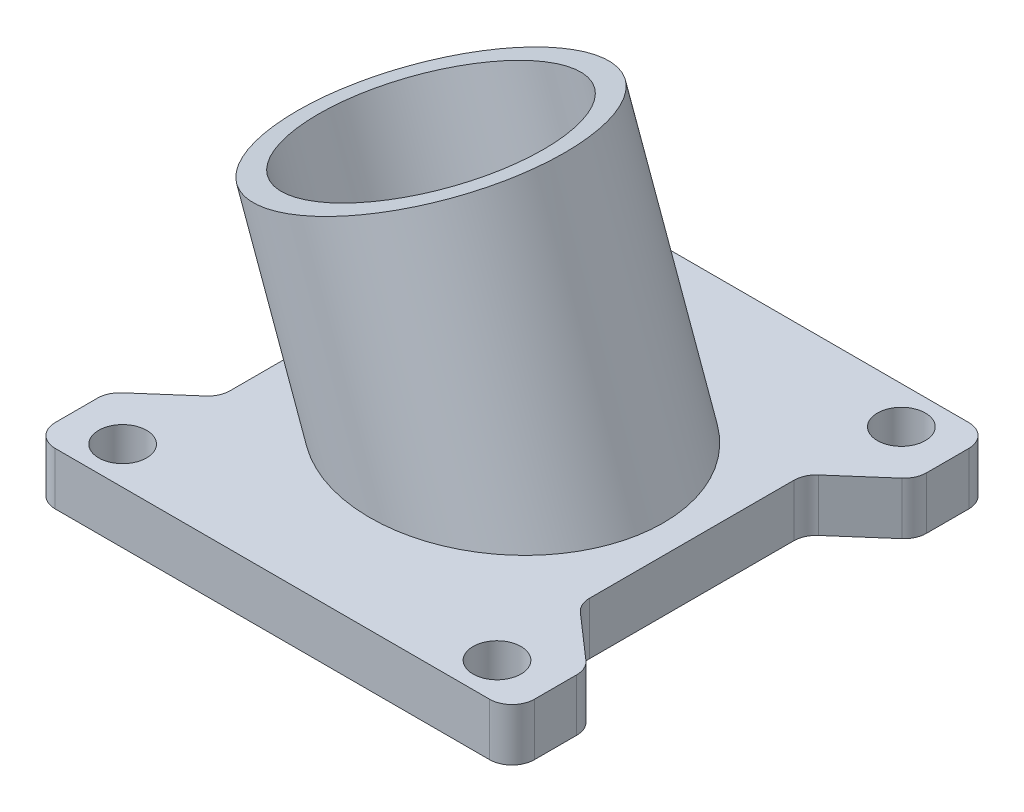
from build123d import *

# Parameters (mm, degrees)
BOSS_EXTRUDE1_DEPTH             = 3.5
CUT_EXTRUDE1_REACH              = 24.897
SKETCH2_R                       = 1.6
FILLET1_R                       = 1.5
FILLET1_OF_MIRROR1_R            = 1.5
SKETCH3_R                       = 9.5
SKETCH3_R_2                     = 8
BOSS_EXTRUDE3_DEPTH             = 15
BOSS_EXTRUDE3_DIRECTION_2_REACH = 25.953


with BuildPart() as part:
    # Sketch1 → Boss-Extrude1 (new body)
    with BuildSketch(Plane(origin=(0, 0, 0), x_dir=(1, 0, 0), z_dir=(0, 1, 0))):
        Polygon((-12, 0), (-12, 7.5), (-16, 11), (-16, 16), (16, 16), (16, 11), (12, 7.5), (12, 0), align=None)
    boss_extrude1 = extrude(amount=BOSS_EXTRUDE1_DEPTH)

    # Sketch2 → Cut-Extrude1 (cut, up to next)
    with BuildSketch(Plane(origin=(0, 3.5, 0), x_dir=(1, 0, 0), z_dir=(0, 1, 0)), mode=Mode.PRIVATE) as cut_extrude1_sk1:
        with Locations(Location((-12.5, 13.5, 0), (0, 0, 270))):
            Circle(SKETCH2_R)
    cut_extrude1_tool1 = extrude(cut_extrude1_sk1.sketch, amount=-CUT_EXTRUDE1_REACH, mode=Mode.PRIVATE) & part.part
    # Sketch2 → Cut-Extrude1 (cut, up to next)
    with BuildSketch(Plane(origin=(0, 3.5, 0), x_dir=(1, 0, 0), z_dir=(0, 1, 0)), mode=Mode.PRIVATE) as cut_extrude1_sk2:
        with Locations(Location((12.5, 13.5, 0), (0, 0, 270))):
            Circle(SKETCH2_R)
    cut_extrude1_tool2 = extrude(cut_extrude1_sk2.sketch, amount=-CUT_EXTRUDE1_REACH, mode=Mode.PRIVATE) & part.part
    cut_extrude1_1 = cut_extrude1_tool1.solids().sort_by_distance((-12.5, 3.5, -13.5))[0]
    add(cut_extrude1_1, mode=Mode.SUBTRACT)
    cut_extrude1_2 = cut_extrude1_tool2.solids().sort_by_distance((12.5, 3.5, -13.5))[0]
    add(cut_extrude1_2, mode=Mode.SUBTRACT)
    cut_extrude1 = cut_extrude1_1 + cut_extrude1_2  # Cut-Extrude1 as one shape, for the pattern or mirror that repeats it

    # Fillet1
    fillet1_edges = [part.edges().sort_by_distance(p)[0] for p in [
        (-12, 1.75, -7.5),
        (-16, 1.75, -11),
        (-16, 1.75, -16),
        (16, 1.75, -16),
        (16, 1.75, -11),
        (12, 1.75, -7.5),
    ]]
    fillet(fillet1_edges, radius=FILLET1_R)

    # Mirror1: Boss-Extrude1, Cut-Extrude1 across plane
    add(boss_extrude1.mirror(Plane.XY))
    add(cut_extrude1.mirror(Plane.XY), mode=Mode.SUBTRACT)

    # Fillet1 of Mirror1
    fillet1_of_mirror1_edges = [part.edges().sort_by_distance(p)[0] for p in [
        (-12, 1.75, 7.5),
        (-16, 1.75, 11),
        (-16, 1.75, 16),
        (16, 1.75, 16),
        (16, 1.75, 11),
        (12, 1.75, 7.5),
    ]]
    fillet(fillet1_of_mirror1_edges, radius=FILLET1_OF_MIRROR1_R)

    # Sketch3 → Boss-Extrude3 (add)
    with BuildSketch(Plane(origin=(-1.403733341, 3.856725658, 0), x_dir=(0, 0, 1), z_dir=(-0.34202014332566977, 0.939692620785908, 0))):
        with Locations(Location((0, 1.197070502, 0), (0, 0, 270))):
            Circle(SKETCH3_R)
        with Locations(Location((0, 1.197070502, 0), (0, 0, 270))):
            Circle(SKETCH3_R_2, mode=Mode.SUBTRACT)
    extrude(amount=BOSS_EXTRUDE3_DEPTH)

    # Boss-Extrude3 direction 2: up to this face of the body (flat: up to its plane)
    boss_extrude3_direction_2_end = Plane(part.part.faces().sort_by_distance((0, 3.5, 0))[0])
    # Sketch3 → Boss-Extrude3 direction 2 (add, up to the picked face)
    with BuildSketch(Plane(origin=(-1.403733341, 3.856725658, 0), x_dir=(0, 0, 1), z_dir=(-0.34202014332566977, 0.939692620785908, 0)), mode=Mode.PRIVATE) as boss_extrude3_direction_2_sk1:
        with Locations(Location((0, 1.197070502, 0), (0, 0, 270))):
            Circle(SKETCH3_R)
        with Locations(Location((0, 1.197070502, 0), (0, 0, 270))):
            Circle(SKETCH3_R_2, mode=Mode.SUBTRACT)
    boss_extrude3_direction_2_tool1 = split(extrude(boss_extrude3_direction_2_sk1.sketch, amount=-BOSS_EXTRUDE3_DIRECTION_2_REACH, mode=Mode.PRIVATE), bisect_by=boss_extrude3_direction_2_end, keep=Keep.BOTH, mode=Mode.PRIVATE)
    add(boss_extrude3_direction_2_tool1.solids().sort_by(Axis((8.395729, 7.423438, 0), (0.34202014332566977, -0.939692620785908, 0)))[0])


solid = part.part
